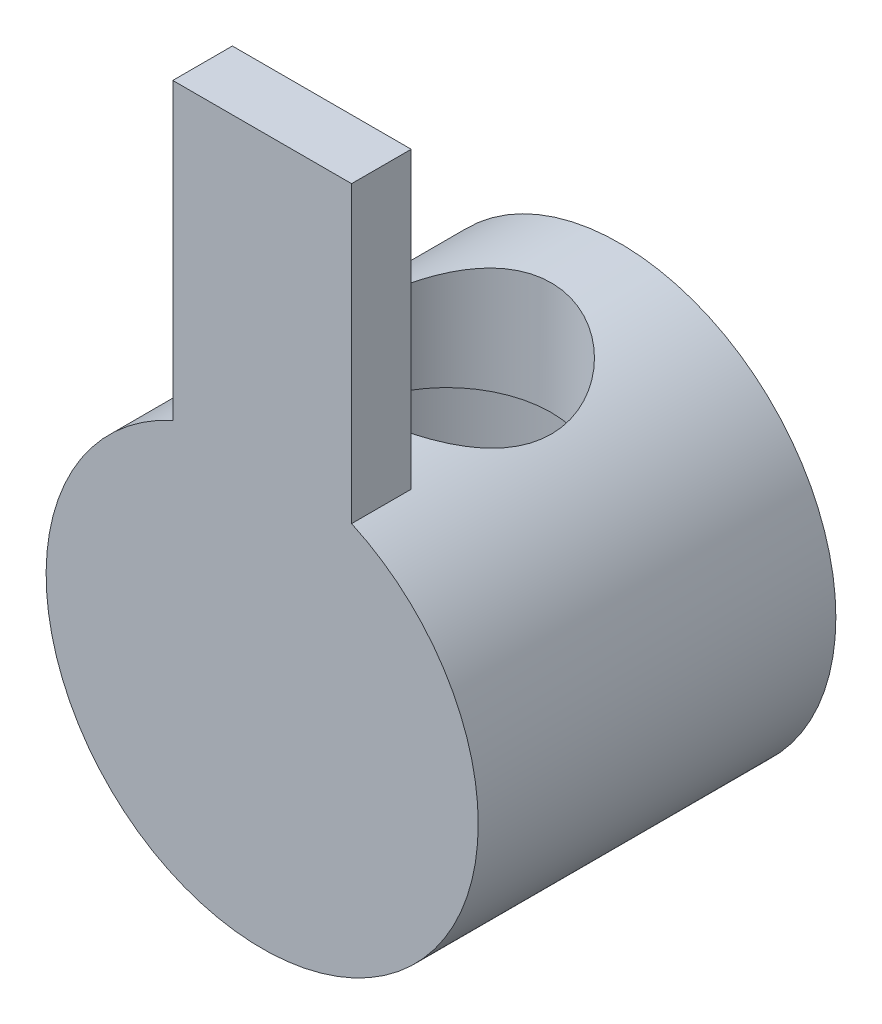
from build123d import *

# Parameters (mm, degrees)
SKETCH_1_W               = 6
SKETCH_1_H               = 23
EXTRUDE_1_DEPTH          = 2
SKETCH_4_W               = 6
SKETCH_4_H               = 4.448435562
CUT_EXTRUDE_1_DEPTH      = 13.051970793
SKETCH_2_R               = 7.25
EXTRUDE_2_DEPTH          = 12
SKETCH_5_R               = 3.5
CUT_EXTRUDE_2_DEPTH      = 27.752110197
CUT_EXTRUDE_3_DEPTH      = 2.75
CUT_EXTRUDE_3_DEPTH_BACK = 10
SKETCH_6_R               = 5


with BuildPart() as part:
    # 草图1 → 凸台-拉伸1 (new body)
    with BuildSketch(Plane.XY):
        Rectangle(SKETCH_1_W, SKETCH_1_H)
    extrude(amount=EXTRUDE_1_DEPTH)

    # 草图4 → 切除-拉伸1 (cut, through all)
    with BuildSketch(Plane(origin=(0, 0, 0), x_dir=(-1, 0, 0), z_dir=(0, 0, -1))):
        with Locations((0, -9.275782219)):
            Rectangle(SKETCH_4_W, SKETCH_4_H)
    extrude(amount=-CUT_EXTRUDE_1_DEPTH, mode=Mode.SUBTRACT)

    # 草图2 → 凸台-拉伸2 (add)
    with BuildSketch(Plane.XY.offset(2)):
        with Locations((0, -4.98)):
            Circle(SKETCH_2_R)
    extrude(amount=-EXTRUDE_2_DEPTH)

    # 草图5 → 切除-拉伸2 (cut, through all)
    with BuildSketch(Plane(origin=(0, 11.5, 0), x_dir=(1, 0, 0), z_dir=(0, 1, 0))):
        with Locations(Location((0, 4.2, 0), (0, 0, 270))):
            Circle(SKETCH_5_R)
    extrude(amount=-CUT_EXTRUDE_2_DEPTH, mode=Mode.SUBTRACT)

    # 草图6 → 切除-拉伸3 (cut, two sides: drawn at the far end of the back side and taken through both)
    with BuildSketch(Plane(origin=(0, -4.25, 0), x_dir=(1, 0, 0), z_dir=(0, 1, 0)).offset(-CUT_EXTRUDE_3_DEPTH_BACK)):
        with Locations(Location((0, 4.2, 0), (0, 0, 90))):
            Circle(SKETCH_6_R)
    extrude(amount=CUT_EXTRUDE_3_DEPTH + CUT_EXTRUDE_3_DEPTH_BACK, mode=Mode.SUBTRACT)


solid = part.part
